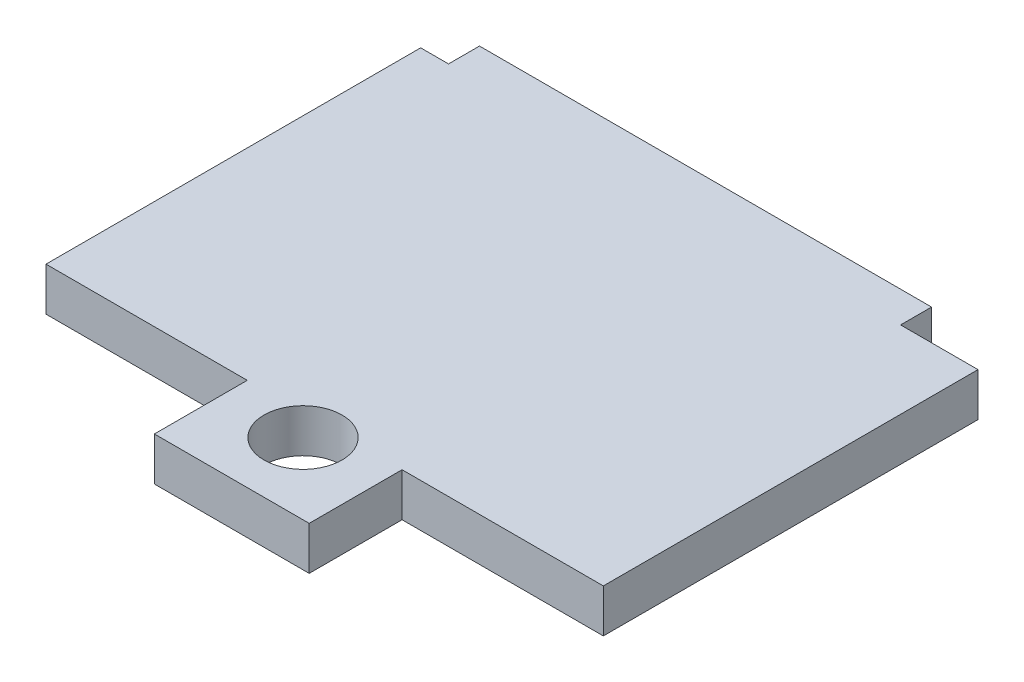
from build123d import *

# Parameters (mm, degrees)
BOSS_EXTRUDE1_DEPTH  = 1.778
M3_CLEARANCE_HOLE1_D = 3.2
SKETCH4_W            = 2.54
SKETCH4_H            = 9.144
BOSS_EXTRUDE2_DEPTH  = 1.143
CUT_EXTRUDE1_DEPTH   = 0.508


with BuildPart() as part:
    # Sketch1 → Boss-Extrude1 (new body)
    with BuildSketch(Plane(origin=(0, 0, 0), x_dir=(1, 0, 0), z_dir=(0, 1, 0))):
        Polygon((0, 15.367), (0, 0), (8.255, 0), (8.255, -3.81), (14.605, -3.81), (14.605, 0), (22.86, 0), (22.86, 15.367), (19.685, 15.367), (19.685, 16.637), (1.143, 16.637), (1.143, 15.367), align=None)
    extrude(amount=BOSS_EXTRUDE1_DEPTH)

    # M3 Clearance Hole1 (through all)
    with Locations(Plane(origin=(0, 1.778, 0), x_dir=(1, 0, 0), z_dir=(0, 1, 0))):
        with Locations((11.43, -0.888075369)):
            Hole(M3_CLEARANCE_HOLE1_D / 2)

    # Sketch4 → Boss-Extrude2 (add)
    with BuildSketch(Plane.XZ):
        with Locations((16.51, -8.874849992)):
            Rectangle(SKETCH4_W, SKETCH4_H)
        with Locations((1.27, -8.874849992)):
            Rectangle(SKETCH4_W, SKETCH4_H)
    extrude(amount=BOSS_EXTRUDE2_DEPTH)

    # Sketch6 → Cut-Extrude1 (cut)
    # profile 1 of 2: a face of its own
    with BuildSketch(Plane.XZ):
        Polygon((7.792887548, -6.937433067), (7.970271363, -6.937433067), (7.970271363, -9.315638195), (8.374117516, -9.315638195), (8.374117516, -9.719484349), (7.970271363, -9.719484349), (7.970271363, -10.527176657), (7.521553414, -10.527176657), (7.521553414, -9.719484349), (5.906168798, -9.719484349), align=None)
        Polygon((7.521553414, -9.315638195), (7.521553414, -7.923911433), (6.630427613, -9.315638195), align=None, mode=Mode.SUBTRACT)
    # profile 2 of 2: a face of its own
    with BuildSketch(Plane.XZ):
        with BuildLine():
            Line((10.931809824, -7.027176657), (10.931809824, -7.431022811))
            Line((10.931809824, -7.431022811), (9.78197008, -7.431022811))
            Line((9.78197008, -7.431022811), (9.594069439, -8.260449894))
            add(Edge.make_bspline(
                [(9.594069439, -8.260449894), (9.615990404, -8.249885481), (9.661103923, -8.228143835), (9.736526874, -8.209200238), (9.818414717, -8.195871542), (9.875622645, -8.194537138), (9.905367516, -8.193843324)],
                knots=[0, 0, 0, 0, 0.906577793, 1.865744317, 2.890308309, 4, 4, 4, 4], degree=3))
            add(Edge.make_bspline(
                [(9.905367516, -8.193843324), (9.947495326, -8.194614643), (10.030206236, -8.196129001), (10.150750761, -8.213051384), (10.265618253, -8.23840338), (10.373863762, -8.27622385), (10.476723422, -8.322782641), (10.573081318, -8.381044204), (10.66283737, -8.450020231), (10.745871527, -8.528536241), (10.821549898, -8.614059011), (10.886547349, -8.706415291), (10.942889062, -8.802907042), (10.98754851, -8.905201736), (11.022834099, -9.012241242), (11.047928323, -9.124472926), (11.063881421, -9.241560513), (11.065569539, -9.321428782), (11.066425209, -9.361912234)],
                knots=[0, 0, 0, 0, 1.094894284, 2.149641875, 3.159658044, 4.149576056, 5.125966368, 6.091225838, 7.071072142, 8.064343292, 9.05924964, 10.03573454, 10.996966885, 11.96032995, 12.932910184, 13.923798045, 14.947619342, 16, 16, 16, 16], degree=3))
            add(Edge.make_bspline(
                [(11.066425209, -9.361912234), (11.06576722, -9.390201132), (11.064465608, -9.446161323), (11.057683043, -9.529370503), (11.044736374, -9.610784817), (11.027546624, -9.691033112), (11.003860501, -9.769427433), (10.97689686, -9.84701), (10.943769877, -9.922543999), (10.905950095, -9.995997939), (10.863989349, -10.066834257), (10.817788624, -10.134193652), (10.767242359, -10.197537594), (10.712171199, -10.256335904), (10.654080504, -10.312100821), (10.59145493, -10.363376929), (10.524472443, -10.410379599), (10.454088485, -10.453622636), (10.380336705, -10.492689435), (10.302783653, -10.525035952), (10.223354637, -10.554425694), (10.140085205, -10.576431812), (10.054545441, -10.594949081), (9.965708783, -10.607237727), (9.874197953, -10.615249641), (9.812135855, -10.616356991), (9.780567837, -10.616920247)],
                knots=[0, 0, 0, 0, 1.012275937, 2.002451767, 2.98397589, 3.959820946, 4.936095762, 5.911940818, 6.896771482, 7.884012822, 8.866284557, 9.840372785, 10.804070441, 11.762530572, 12.720625922, 13.68308951, 14.655094125, 15.646011038, 16.637104318, 17.63729087, 18.650257215, 19.66446511, 20.715636712, 21.77986274, 22.870722459, 24, 24, 24, 24], degree=3))
            add(Edge.make_bspline(
                [(9.780567837, -10.616920247), (9.74501295, -10.616066651), (9.67487051, -10.614382685), (9.571851951, -10.602438699), (9.473022547, -10.582173288), (9.378801083, -10.553163592), (9.288486547, -10.516777369), (9.202848927, -10.471765507), (9.121555434, -10.418531983), (9.044501382, -10.358091639), (8.974225046, -10.289145312), (8.909445749, -10.214922365), (8.854253251, -10.132690105), (8.805700589, -10.044717841), (8.763983147, -9.950290059), (8.73079481, -9.849227723), (8.704256829, -9.74191356), (8.693649883, -9.66772079), (8.68822008, -9.62974076)],
                knots=[0, 0, 0, 0, 1.049569621, 2.070583864, 3.057046508, 4.023914414, 4.977170942, 5.927726879, 6.875021894, 7.842677272, 8.813672282, 9.777581439, 10.74592533, 11.731059957, 12.74126976, 13.788569057, 14.867946107, 16, 16, 16, 16], degree=3))
            Line((8.68822008, -9.62974076), (9.126421202, -9.62974076))
            add(Edge.make_bspline(
                [(9.126421202, -9.62974076), (9.134761141, -9.66642032), (9.150417161, -9.735276452), (9.184050813, -9.829097607), (9.220098703, -9.908893266), (9.264188523, -9.974152261), (9.314792456, -10.027719829), (9.370959214, -10.074218016), (9.432665368, -10.115927928), (9.500597498, -10.150550709), (9.572171535, -10.17860074), (9.646539379, -10.198177788), (9.722199143, -10.210487725), (9.773277222, -10.212212404), (9.798797004, -10.213074093)],
                knots=[0, 0, 0, 0, 1.385459112, 2.600831482, 3.66841355, 4.605180919, 5.48910649, 6.376050311, 7.288896949, 8.229144678, 9.181161654, 10.117453426, 11.059436513, 12, 12, 12, 12], degree=3))
            add(Edge.make_bspline(
                [(9.798797004, -10.213074093), (9.826403635, -10.212147278), (9.880907737, -10.210317457), (9.9612011, -10.199363174), (10.03799139, -10.179100678), (10.112387313, -10.152836823), (10.183089403, -10.117064359), (10.251833101, -10.075295418), (10.316111719, -10.02400433), (10.377721757, -9.966974677), (10.434150348, -9.903805344), (10.483285658, -9.835553671), (10.525200218, -9.763590176), (10.558602509, -9.687436209), (10.585711354, -9.607789577), (10.60434487, -9.524106273), (10.615970273, -9.436561106), (10.617120647, -9.376907087), (10.61770726, -9.346487554)],
                knots=[0, 0, 0, 0, 0.99750234, 1.969380735, 2.919490565, 3.862219911, 4.813679117, 5.776605688, 6.762898166, 7.778387729, 8.806918829, 9.816812977, 10.811632172, 11.809420289, 12.815921014, 13.846113939, 14.901663155, 16, 16, 16, 16], degree=3))
            add(Edge.make_bspline(
                [(10.61770726, -9.346487554), (10.61700976, -9.319346395), (10.615640161, -9.266052481), (10.605607573, -9.18816159), (10.589693867, -9.113863306), (10.566569889, -9.043856082), (10.536844883, -8.977752547), (10.500292329, -8.915975577), (10.457023625, -8.858181151), (10.408363657, -8.804181975), (10.353279511, -8.755933356), (10.294135331, -8.712751732), (10.2291352, -8.677827545), (10.160623288, -8.647941478), (10.087014842, -8.626099622), (10.009628455, -8.608500045), (9.927054225, -8.6000444), (9.870558601, -8.59848814), (9.841565433, -8.597689477)],
                knots=[0, 0, 0, 0, 1.071512717, 2.104004018, 3.095982969, 4.067795438, 5.009520676, 5.952827242, 6.895998369, 7.856350385, 8.817411605, 9.782937659, 10.74115891, 11.725120868, 12.729302161, 13.768330494, 14.854722481, 16, 16, 16, 16], degree=3))
            add(Edge.make_bspline(
                [(9.841565433, -8.597689477), (9.816772294, -8.598284479), (9.764721648, -8.599533624), (9.683271646, -8.608565862), (9.594637888, -8.622772307), (9.498960529, -8.6424206), (9.396147628, -8.66801835), (9.286074253, -8.699036547), (9.168618604, -8.735231112), (9.088481339, -8.762914245), (9.047194439, -8.777176657)],
                knots=[0, 0, 0, 0, 0.727614075, 1.527550888, 2.402655696, 3.361819828, 4.39328773, 5.511706796, 6.718025739, 8, 8, 8, 8], degree=3))
            Line((9.047194439, -8.777176657), (9.41458226, -7.027176657))
            Line((9.41458226, -7.027176657), (10.931809824, -7.027176657))
        make_face()
    extrude(amount=-CUT_EXTRUDE1_DEPTH, mode=Mode.SUBTRACT)


solid = part.part
